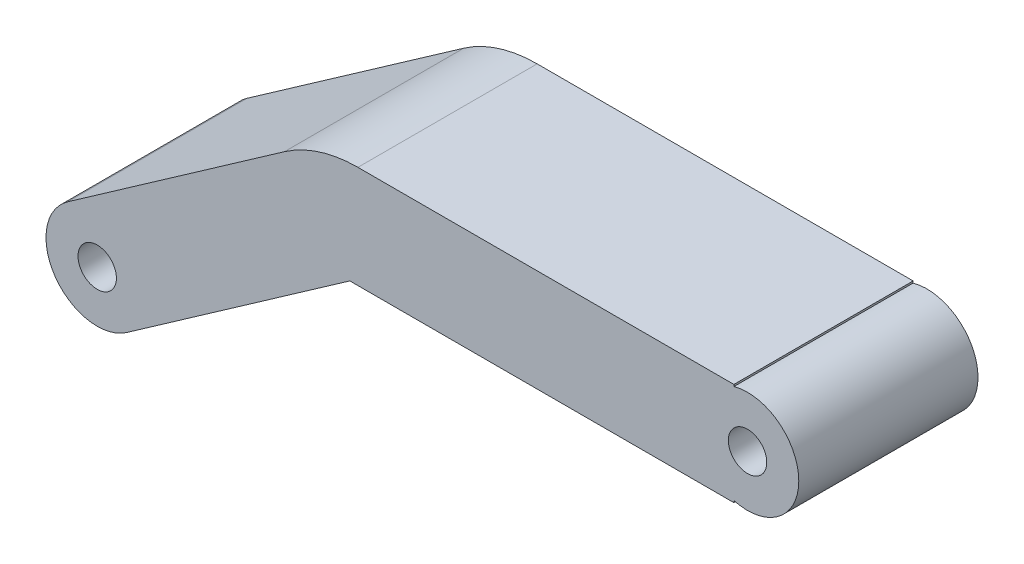
from build123d import *

# Parameters (mm, degrees)
SKETCH_1_R      = 1.5
EXTRUDE_2_DEPTH = 14
FILLET_1_R      = 10


with BuildPart() as part:
    # 草图1 → 凸台-拉伸2 (new body)
    with BuildSketch(Plane.XY):
        with BuildLine():
            Line((15.60515688, 4.016530447), (15.60515688, 4.161375168))
            Line((15.60515688, 4.161375168), (-16.917233431, 4.161375168))
            Line((-16.917233431, 4.161375168), (-36.422020871, -9.496024029))
            ThreePointArc((-36.422020871, -9.496024029), (-37.404323302, -15.066937951), (-31.83340938, -16.049240383))
            Line((-31.83340938, -16.049240383), (-14.39484312, -3.838624832))
            Line((-14.39484312, -3.838624832), (15.60515688, -3.838624832))
            Line((15.60515688, -3.838624832), (15.60515688, -3.693780111))
            ThreePointArc((15.60515688, -3.693780111), (20.671823547, 0.161375168), (15.60515688, 4.016530447))
        make_face()
        with Locations((-34.127715125, -12.772632206)):
            Circle(SKETCH_1_R, mode=Mode.SUBTRACT)
        with Locations((16.671823547, 0.161375168)):
            Circle(SKETCH_1_R, mode=Mode.SUBTRACT)
    extrude(amount=EXTRUDE_2_DEPTH)

    # 圆角1
    fillet_1_edges = [part.edges().sort_by_distance(p)[0] for p in [
        (-16.917233431, 4.161375168, 7),
    ]]
    fillet(fillet_1_edges, radius=FILLET_1_R)


solid = part.part
